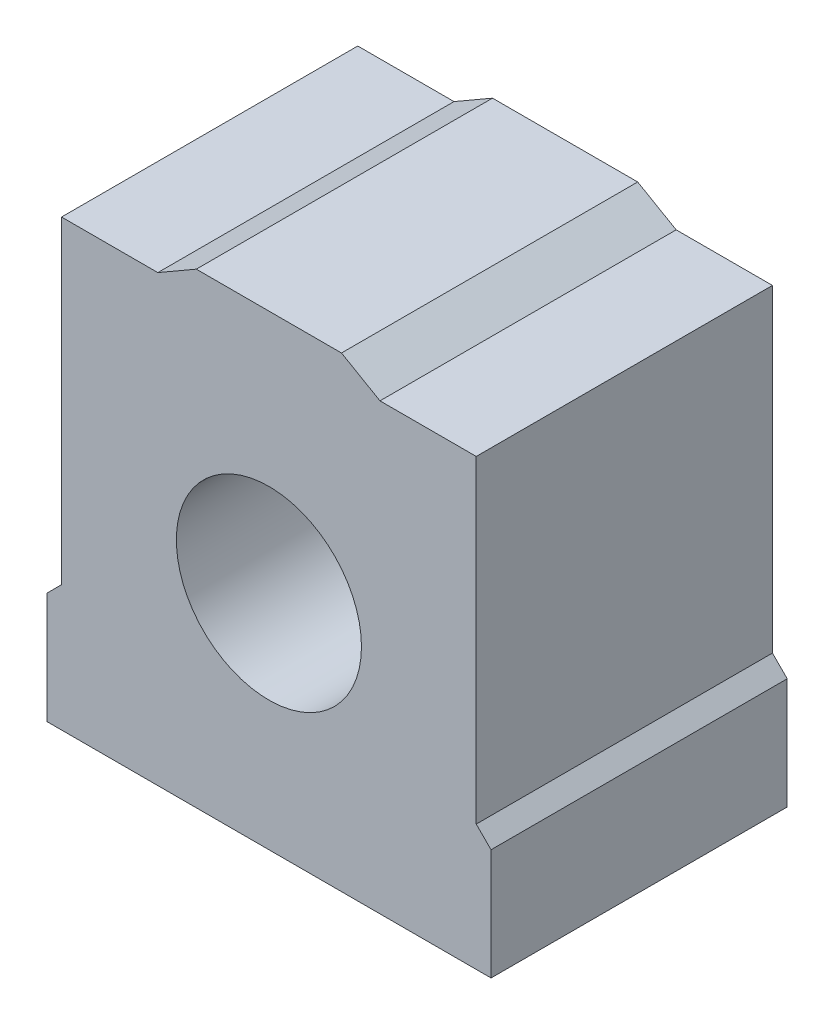
from build123d import *

# Parameters (mm, degrees)
CROQUIS1_R                    = 12.5
SALIENTE_EXTRUIR1_DEPTH       = 20
TALADRO_ROSCADO_1_4_201_D     = 5.1054
TALADRO_ROSCADO_1_4_201_DEPTH = 19.05
TALADRO_ROSCADO_1_4_201_TIP   = 1.533816902


with BuildPart() as part:
    # Croquis1 → Saliente-Extruir1 (new, symmetric)
    with BuildSketch(Plane.XY):
        Polygon((28, 60), (15, 60), (9.803847577, 63), (-9.803847577, 63), (-15, 60), (-28, 60), (-28, 17), (-30, 15), (-30, 0), (30, 0), (30, 15), (28, 17), align=None)
        with Locations((0, 30)):
            Circle(CROQUIS1_R, mode=Mode.SUBTRACT)
    extrude(amount=SALIENTE_EXTRUIR1_DEPTH, both=True)

    # Taladro roscado 1/4-201
    with Locations(Plane(origin=(0, 0, 0), x_dir=(-1, 0, 0), z_dir=(0, -1, 0))):
        with Locations((20, 10), (20, -10), (-20, -10), (-20, 10)):
            Hole(TALADRO_ROSCADO_1_4_201_D / 2, depth=TALADRO_ROSCADO_1_4_201_DEPTH)
            with Locations((0, 0, -(TALADRO_ROSCADO_1_4_201_DEPTH + TALADRO_ROSCADO_1_4_201_TIP / 2))):  # 118° drill point
                Cone(0, TALADRO_ROSCADO_1_4_201_D / 2, TALADRO_ROSCADO_1_4_201_TIP, mode=Mode.SUBTRACT)


solid = part.part
